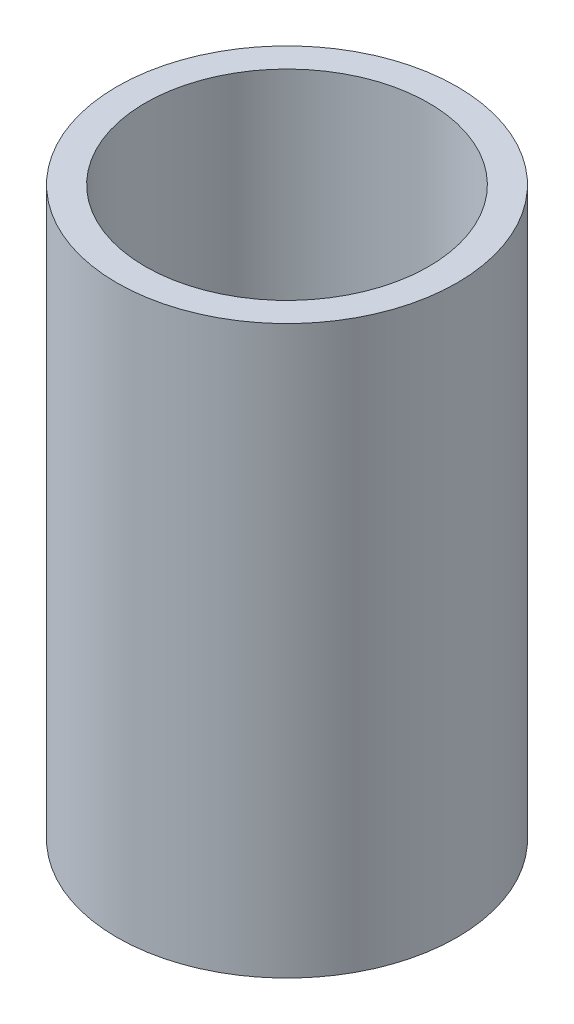
from build123d import *

# Parameters (mm, degrees)
SKETCH_1_R      = 15
SKETCH_1_R_2    = 12.5
EXTRUDE_1_DEPTH = 50


with BuildPart() as part:
    # Эскиз1 → Вытянуть1 (new body)
    with BuildSketch(Plane(origin=(0, 0, 0), x_dir=(1, 0, 0), z_dir=(0, 1, 0))):
        with Locations(Location((0, 0, 0), (0, 0, 270))):
            Circle(SKETCH_1_R)
        with Locations(Location((0, 0, 0), (0, 0, 270))):
            Circle(SKETCH_1_R_2, mode=Mode.SUBTRACT)
    extrude(amount=EXTRUDE_1_DEPTH)


solid = part.part
